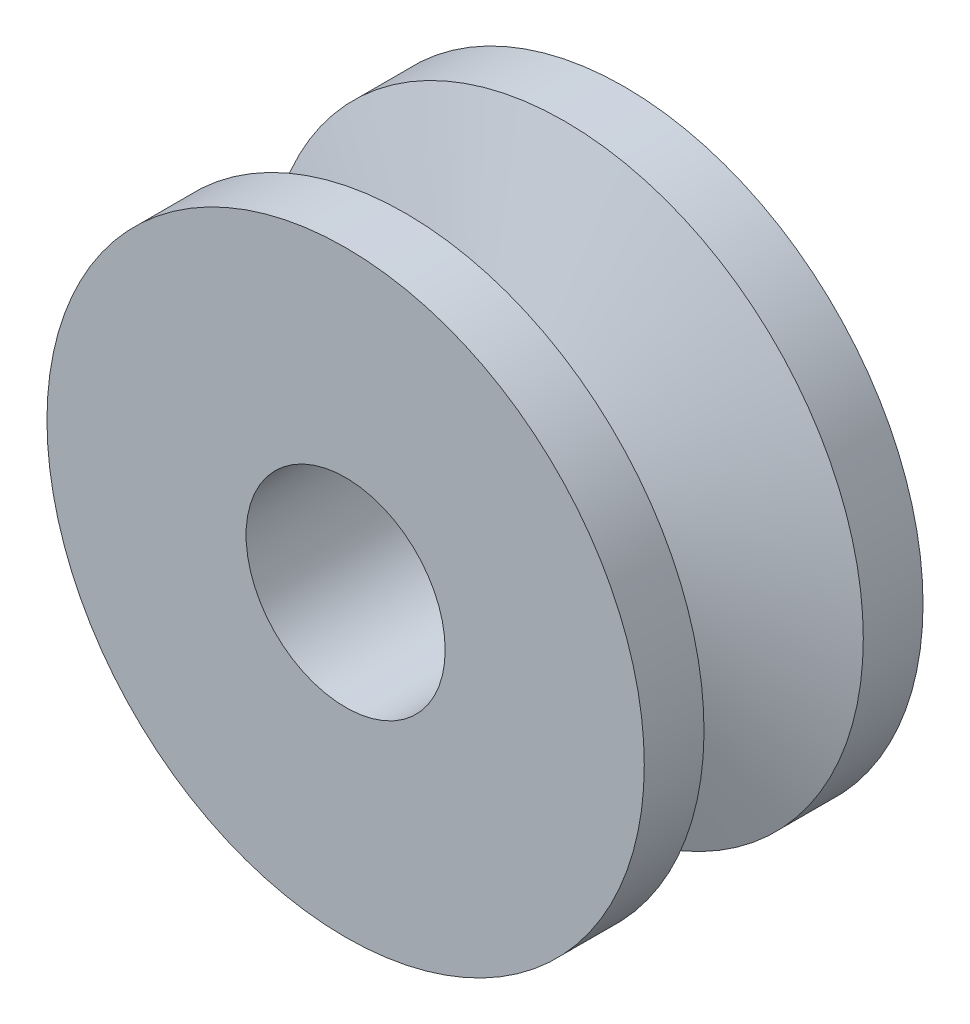
from build123d import *
from build123d.topology import SkipClean

# Parameters (mm, degrees)
SKETCH1_R           = 7.5
SKETCH1_R_2         = 2.5
BOSS_EXTRUDE1_DEPTH = 7
CUT_EXTRUDE2_REACH  = 14.708


with BuildPart() as part:
    # Sketch1 → Boss-Extrude1 (new body)
    with BuildSketch(Plane.XY):
        Circle(SKETCH1_R)
        Circle(SKETCH1_R_2, mode=Mode.SUBTRACT)
    extrude(amount=BOSS_EXTRUDE1_DEPTH)

    # Sketch2 → Cut-Revolve1 (revolve, cut)
    with BuildSketch(Plane(origin=(0, 0, 0), x_dir=(1, 0, 0), z_dir=(0, 1, 0)), mode=Mode.PRIVATE) as cut_revolve1_sk:
        Polygon((3, -4), (3, -3), (7.5, -1.5), (7.5, -5.5), align=None)
    revolve(cut_revolve1_sk.sketch.rotate(Axis((0, 0, 0), (0, 0, 1)), 180), axis=Axis((0, 0, 0), (0, 0, 1)), mode=Mode.SUBTRACT)

    # Cut-Extrude2: up to this cone (the profile starts outside it)
    with SkipClean():  # the faces are left unmerged after this step: merging them gives an invalid solid
        cut_extrude2_end = Plane(origin=(0, 0, 0), z_dir=(0, 0, 1)).offset(3.000001) * Cone(3e-06, 36.624, 12.207999, align=(Align.CENTER, Align.CENTER, Align.MIN), mode=Mode.PRIVATE)
        # Sketch3 → Cut-Extrude2 (cut, up to the surface)
        with BuildSketch(Plane.XY, mode=Mode.PRIVATE) as cut_extrude2_sk1:
            with BuildLine():
                Line((-0.768114575, -2.9), (0.768114575, -2.9))
                ThreePointArc((0.768114575, -2.9), (0, -3), (-0.768114575, -2.9))
            make_face()
        cut_extrude2_tool1 = extrude(cut_extrude2_sk1.sketch, amount=CUT_EXTRUDE2_REACH, mode=Mode.PRIVATE) - cut_extrude2_end
        add(cut_extrude2_tool1.solids().sort_by_distance((0, -2.940058, 0))[0], mode=Mode.SUBTRACT)


solid = part.part
